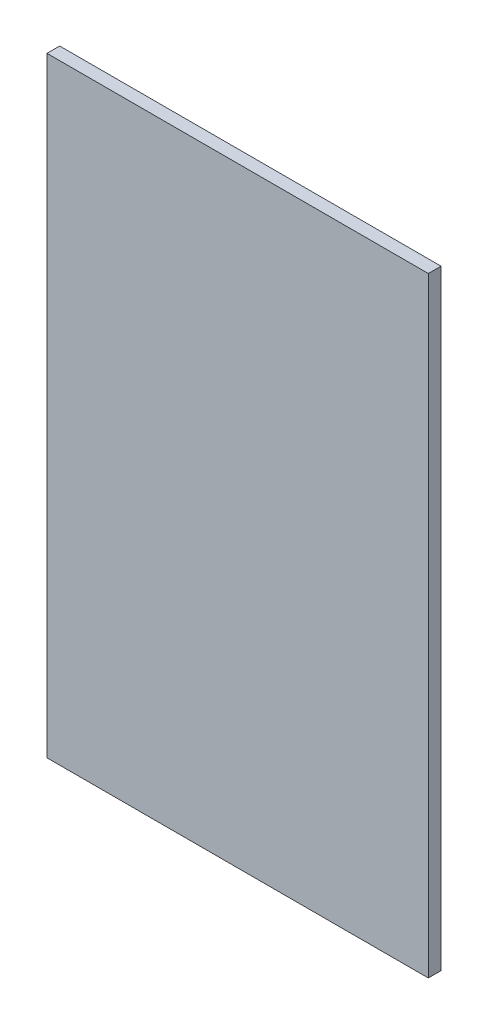
from build123d import *

# Parameters (mm, degrees)
ESQUISSE1_W             = 210
ESQUISSE1_H             = 240
BOSS_EXTRU_1_DEPTH      = 5
ESQUISSE3_W             = 120
ESQUISSE3_H             = 240
ENL_V_MAT_EXTRU_2_DEPTH = 160.530561335


with BuildPart() as part:
    # Esquisse1 → Boss.-Extru.1 (new body)
    with BuildSketch(Plane.XY):
        Rectangle(ESQUISSE1_W, ESQUISSE1_H)
    extrude(amount=BOSS_EXTRU_1_DEPTH)

    # Esquisse3 → Enlèv. mat.-Extru.2 (cut, through all)
    with BuildSketch(Plane.XY.offset(5)):
        with Locations((105, 0)):
            Rectangle(ESQUISSE3_W, ESQUISSE3_H)
    extrude(amount=-ENL_V_MAT_EXTRU_2_DEPTH, mode=Mode.SUBTRACT)


solid = part.part
